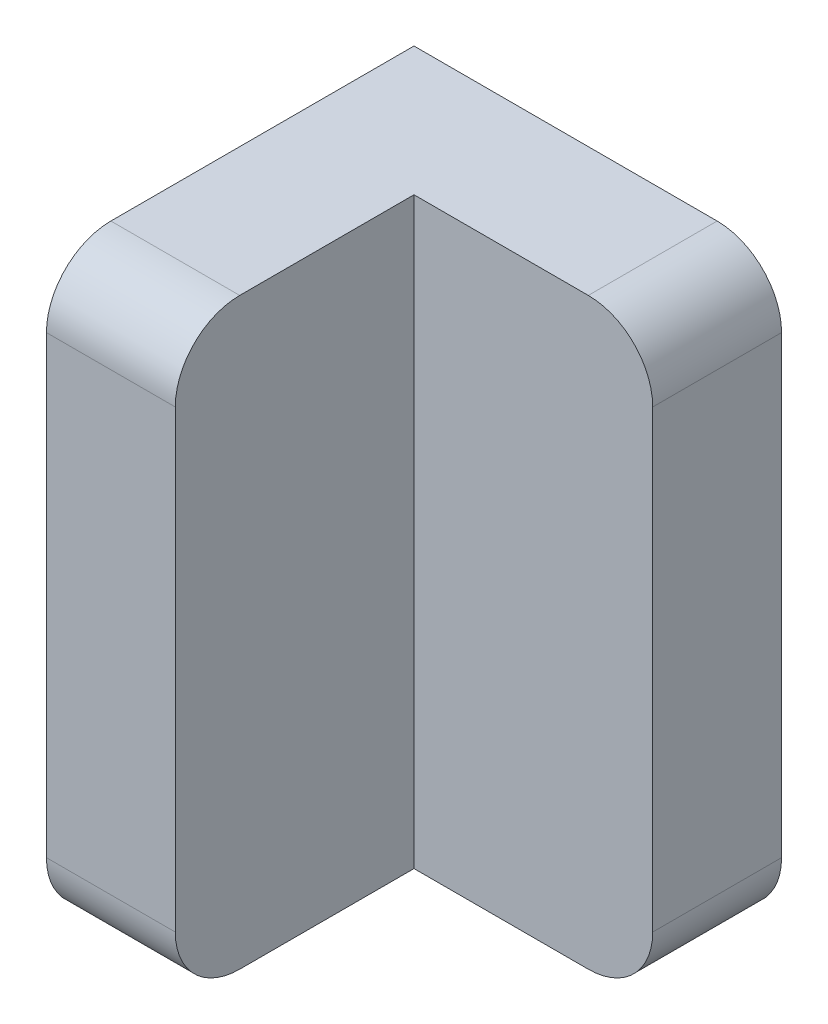
from build123d import *

# Parameters (mm, degrees)
FLUSH_ROOF_LENS_T1_7_CLEARANCE0_15_DEPTH = 1.7
FLUSH_SIDE_LENS_T1_7_CLEARANCE0_15_DEPTH = 1.7


with BuildPart() as part:
    # 草图1 → Flush_roof_lens_T1.7_clearance0.15 (new body)
    with BuildSketch(Plane.XY):
        with BuildLine():
            Line((0, -3.85), (4, -3.85))
            ThreePointArc((4, -3.85), (4.601040764, -3.601040764), (4.85, -3))
            Line((4.85, -3), (4.85, 3))
            ThreePointArc((4.85, 3), (4.601040764, 3.601040764), (4, 3.85))
            Line((4, 3.85), (0, 3.85))
            Line((0, 3.85), (0, -3.85))
        make_face()
    extrude(amount=FLUSH_ROOF_LENS_T1_7_CLEARANCE0_15_DEPTH)

    # 草图2 → Flush_side_lens_T1.7_clearance0.15 (add)
    with BuildSketch(Plane(origin=(0, 0, 0), x_dir=(0, 0, -1), z_dir=(1, 0, 0))):
        with BuildLine():
            Line((0, -3.85), (0, 3.85))
            Line((0, 3.85), (-4, 3.85))
            ThreePointArc((-4, 3.85), (-4.601040764, 3.601040764), (-4.85, 3))
            Line((-4.85, 3), (-4.85, -3))
            ThreePointArc((-4.85, -3), (-4.601040764, -3.601040764), (-4, -3.85))
            Line((-4, -3.85), (0, -3.85))
        make_face()
    extrude(amount=FLUSH_SIDE_LENS_T1_7_CLEARANCE0_15_DEPTH)


solid = part.part
